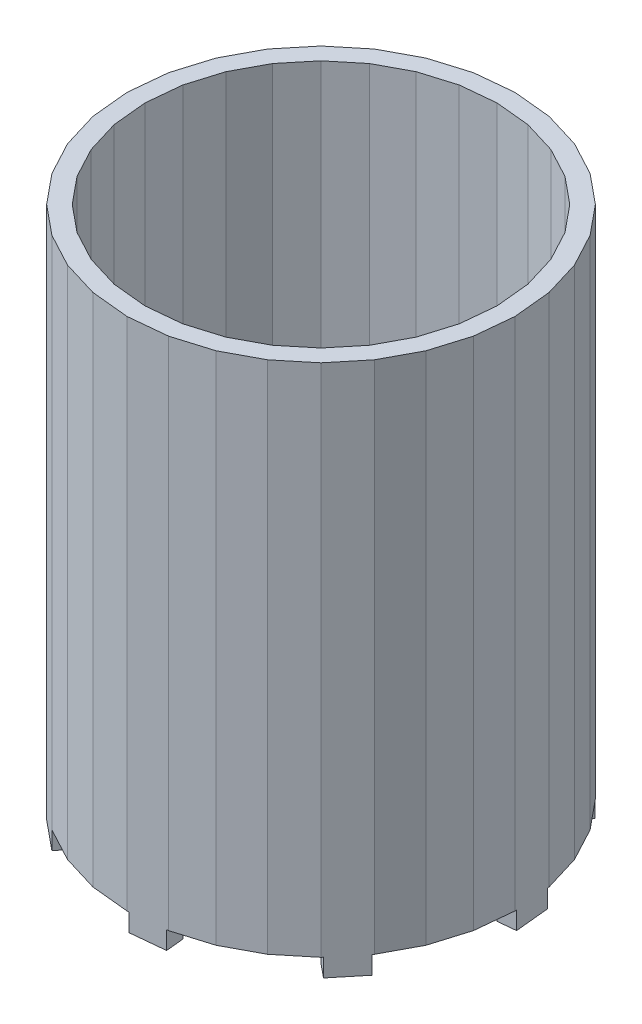
from build123d import *

# Parameters (mm, degrees)
BOSS_EXTRUDE1_DEPTH = 76.2
CUT_EXTRUDE1_DEPTH  = 173.688654555
BOSS_EXTRUDE2_DEPTH = 5.334


with BuildPart() as part:
    # Sketch4 → Boss-Extrude1 (new, symmetric)
    with BuildSketch(Plane(origin=(0, 0, 0), x_dir=(1, 0, 0), z_dir=(0, 1, 0))):
        Polygon((57.426524411, 0), (56.323089847, 11.20335914), (53.055190527, 21.976179471), (47.748409988, 31.904467549), (40.606684831, 40.606684831), (31.904467549, 47.748409988), (21.976179471, 53.055190527), (11.20335914, 56.323089847), (0, 57.426524411), (-11.20335914, 56.323089847), (-21.976179471, 53.055190527), (-31.904467549, 47.748409988), (-40.606684831, 40.606684831), (-47.748409988, 31.904467549), (-53.055190527, 21.976179471), (-56.323089847, 11.20335914), (-57.426524411, 0), (-56.323089847, -11.20335914), (-53.055190527, -21.976179471), (-47.748409988, -31.904467549), (-40.606684831, -40.606684831), (-31.904467549, -47.748409988), (-21.976179471, -53.055190527), (-11.20335914, -56.323089847), (0, -57.426524411), (11.20335914, -56.323089847), (21.976179471, -53.055190527), (31.904467549, -47.748409988), (40.606684831, -40.606684831), (47.748409988, -31.904467549), (53.055190527, -21.976179471), (56.323089847, -11.20335914), align=None)
    extrude(amount=BOSS_EXTRUDE1_DEPTH, both=True)

    # Sketch5 → Cut-Extrude1 (cut, through all)
    with BuildSketch(Plane(origin=(0, 76.2, 0), x_dir=(1, 0, 0), z_dir=(0, 1, 0))):
        Polygon((51.066268128, -10.157712287), (52.066715466, 0), (51.066268128, 10.157712287), (48.103372744, 19.925069387), (43.291891723, 28.926717244), (36.81672758, 36.81672758), (28.926717244, 43.291891723), (19.925069387, 48.103372744), (10.157712287, 51.066268128), (0, 52.066715466), (-10.157712287, 51.066268128), (-19.925069387, 48.103372744), (-28.926717244, 43.291891723), (-36.81672758, 36.81672758), (-43.291891723, 28.926717244), (-48.103372744, 19.925069387), (-51.066268128, 10.157712287), (-52.066715466, 0), (-51.066268128, -10.157712287), (-48.103372744, -19.925069387), (-43.291891723, -28.926717244), (-36.81672758, -36.81672758), (-28.926717244, -43.291891723), (-19.925069387, -48.103372744), (-10.157712287, -51.066268128), (0, -52.066715466), (10.157712287, -51.066268128), (19.925069387, -48.103372744), (28.926717244, -43.291891723), (36.81672758, -36.81672758), (43.291891723, -28.926717244), (48.103372744, -19.925069387), align=None)
    extrude(amount=-CUT_EXTRUDE1_DEPTH, mode=Mode.SUBTRACT)

    # Sketch6 → Boss-Extrude2 (add)
    with BuildSketch(Plane.XZ.offset(76.2)):
        Polygon((-51.066268128, 10.157712287), (-52.066715466, 0), (-57.375030798, 0.522823427), (-56.37458346, 10.680535713), align=None)
        Polygon((57.375030798, -0.522823427), (56.37458346, -10.680535713), (51.066268128, -10.157712287), (52.066715466, 0), align=None)
        Polygon((-47.748409988, -31.904467549), (-40.606684831, -40.606684831), (-36.483447073, -37.222831053), (-43.62517223, -28.520613771), align=None)
        Polygon((36.81672758, -36.81672758), (28.926717244, -43.291891723), (32.310571022, -47.415129481), (40.200581358, -40.939965339), align=None)
        Polygon((47.415129481, 32.310571022), (40.939965339, 40.200581358), (36.81672758, 36.81672758), (43.291891723, 28.926717244), align=None)
        Polygon((-37.222831053, 36.483447073), (-28.520613771, 43.62517223), (-31.904467549, 47.748409988), (-40.606684831, 40.606684831), align=None)
        Polygon((0, 52.066715466), (10.157712287, 51.066268128), (10.680535713, 56.37458346), (0.522823427, 57.375030798), align=None)
        Polygon((-10.680535713, -56.37458346), (-0.522823427, -57.375030798), (0, -52.066715466), (-10.157712287, -51.066268128), align=None)
    extrude(amount=BOSS_EXTRUDE2_DEPTH)


solid = part.part
